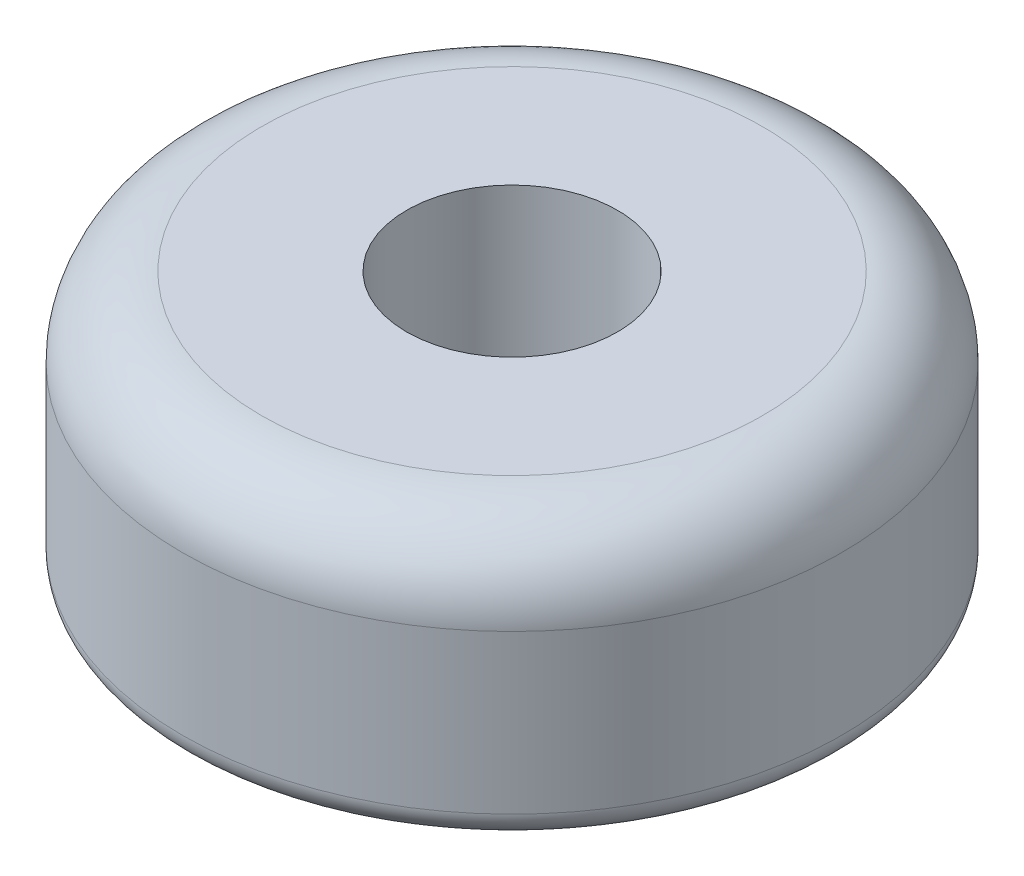
from build123d import *

# Parameters (mm, degrees)
SKETCH1_R           = 12.5
BOSS_EXTRUDE1_DEPTH = 10
FILLET1_R           = 3
SKETCH2_R           = 4
CUT_EXTRUDE1_DEPTH  = 21.310096012
FILLET2_R           = 1


with BuildPart() as part:
    # Sketch1 → Boss-Extrude1 (new body)
    with BuildSketch(Plane(origin=(0, 0, 0), x_dir=(1, 0, 0), z_dir=(0, 1, 0))):
        with Locations(Location((0, 0, 0), (0, 0, 270))):
            Circle(SKETCH1_R)
    extrude(amount=BOSS_EXTRUDE1_DEPTH)

    # Fillet1
    fillet1_edges = [part.edges().sort_by_distance(p)[0] for p in [
        (0, 10, -12.5),
    ]]
    fillet(fillet1_edges, radius=FILLET1_R)

    # Sketch2 → Cut-Extrude1 (cut, through all)
    with BuildSketch(Plane(origin=(0, 10, 0), x_dir=(1, 0, 0), z_dir=(0, 1, 0))):
        with Locations(Location((0, 0, 0), (0, 0, 270))):
            Circle(SKETCH2_R)
    extrude(amount=-CUT_EXTRUDE1_DEPTH, mode=Mode.SUBTRACT)

    # Fillet2
    fillet2_edges = [part.edges().sort_by_distance(p)[0] for p in [
        (0, 0, -12.5),
    ]]
    fillet(fillet2_edges, radius=FILLET2_R)


solid = part.part
